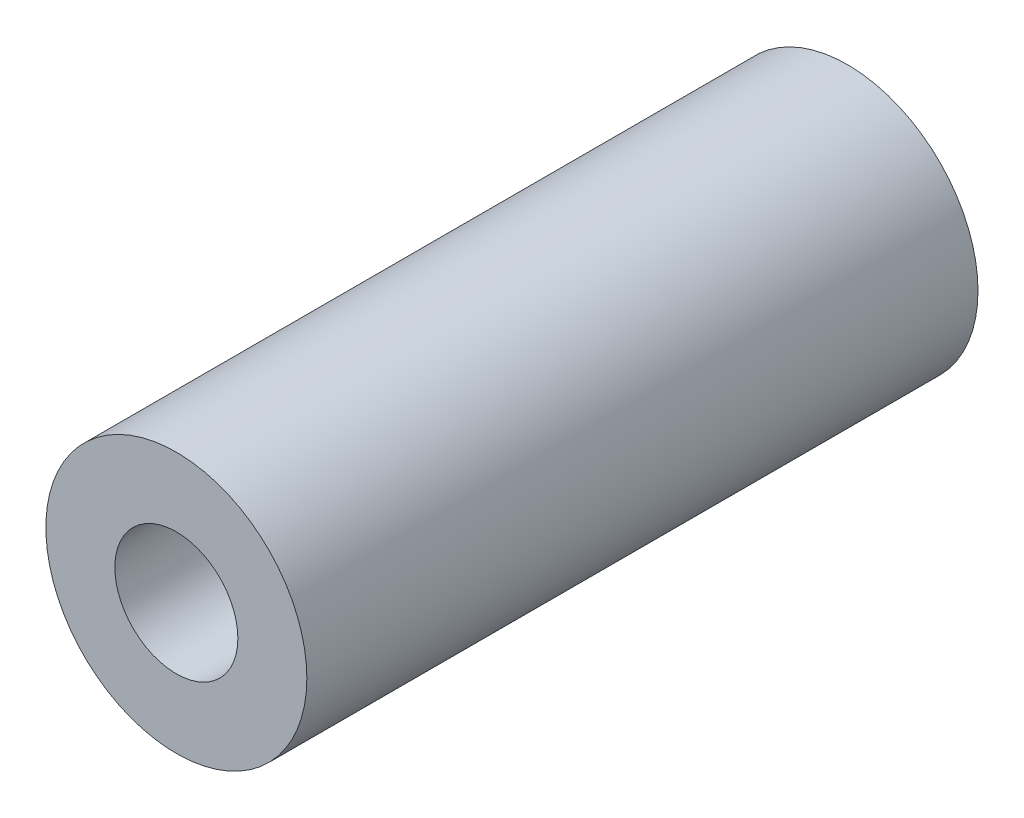
from build123d import *

# Parameters (mm, degrees)
SKETCH1_R           = 3.5
SKETCH1_R_2         = 1.65
BOSS_EXTRUDE1_DEPTH = 18


with BuildPart() as part:
    # Sketch1 → Boss-Extrude1 (new body)
    with BuildSketch(Plane(origin=(0, 0, 0), x_dir=(0, 1, 0), z_dir=(0, 0, 1))):
        with Locations(Location((0, 0, 0), (0, 0, 270))):
            Circle(SKETCH1_R)
        with Locations(Location((0, 0, 0), (0, 0, 270))):
            Circle(SKETCH1_R_2, mode=Mode.SUBTRACT)
    extrude(amount=BOSS_EXTRUDE1_DEPTH)


solid = part.part
